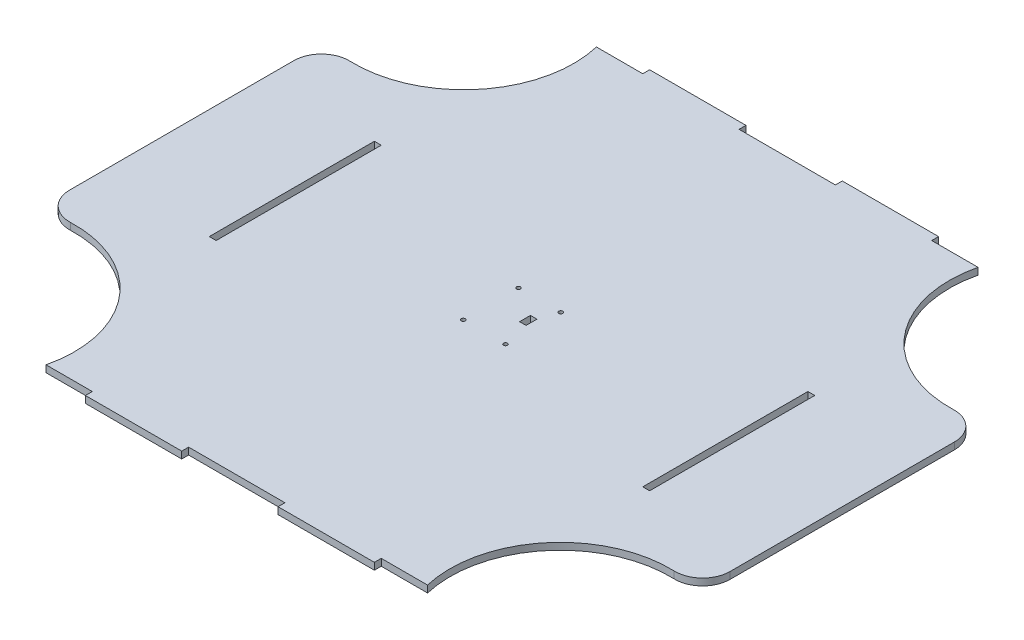
from build123d import *

# Parameters (mm, degrees)
BOSS_EXTRUDE1_DEPTH = 6.35
SKETCH4_W           = 88.9
SKETCH4_H           = 6.35
CUT_EXTRUDE2_DEPTH  = 401.905830589
FILLET2_R           = 25.4
SKETCH6_W           = 6.35
SKETCH6_H           = 152.4
CUT_EXTRUDE3_DEPTH  = 401.905830589
SKETCH7_W           = 6
SKETCH7_H           = 10
SKETCH7_R           = 1.8
CUT_EXTRUDE4_DEPTH  = 401.905830589


with BuildPart() as part:
    # Sketch1 → Boss-Extrude1 (new body)
    with BuildSketch(Plane(origin=(0, 0, 0), x_dir=(1, 0, 0), z_dir=(0, 1, 0))):
        with BuildLine():
            ThreePointArc((-304.8, -133.35), (-203.058992682, -158.608992682), (-177.8, -260.35))
            Line((-177.8, -260.35), (177.8, -260.35))
            ThreePointArc((177.8, -260.35), (203.058992682, -158.608992682), (304.8, -133.35))
            Line((304.8, -133.35), (304.8, 133.35))
            ThreePointArc((304.8, 133.35), (203.058992682, 158.608992682), (177.8, 260.35))
            Line((177.8, 260.35), (-177.8, 260.35))
            ThreePointArc((-177.8, 260.35), (-203.058992682, 158.608992682), (-304.8, 133.35))
            Line((-304.8, 133.35), (-304.8, -133.35))
        make_face()
    extrude(amount=BOSS_EXTRUDE1_DEPTH)

    # Sketch4 → Cut-Extrude2 (cut, through all)
    with BuildSketch(Plane(origin=(0, 6.35, 0), x_dir=(1, 0, 0), z_dir=(0, 1, 0))):
        with Locations((-177.8, 257.175)):
            Rectangle(SKETCH4_W, SKETCH4_H)
        with Locations((0, 257.175)):
            Rectangle(SKETCH4_W, SKETCH4_H)
        with Locations((177.8, 257.175)):
            Rectangle(SKETCH4_W, SKETCH4_H)
    cut_extrude2 = extrude(amount=-CUT_EXTRUDE2_DEPTH, mode=Mode.SUBTRACT)

    # Mirror2: Cut-Extrude2 across plane
    add(cut_extrude2.mirror(Plane.XY), mode=Mode.SUBTRACT)

    # Fillet2
    fillet2_edges = [part.edges().sort_by_distance(p)[0] for p in [
        (-304.8, 3.175, 133.35),
        (-304.8, 3.175, -133.35),
        (304.8, 3.175, -133.35),
        (304.8, 3.175, 133.35),
    ]]
    fillet(fillet2_edges, radius=FILLET2_R)

    # Sketch6 → Cut-Extrude3 (cut, through all)
    with BuildSketch(Plane(origin=(0, 6.35, 0), x_dir=(1, 0, 0), z_dir=(0, 1, 0))):
        with Locations((-200.025, 0)):
            Rectangle(SKETCH6_W, SKETCH6_H)
        with Locations((200.025, 0)):
            Rectangle(SKETCH6_W, SKETCH6_H)
    extrude(amount=-CUT_EXTRUDE3_DEPTH, mode=Mode.SUBTRACT)

    # Sketch7 → Cut-Extrude4 (cut, through all)
    with BuildSketch(Plane(origin=(0, 6.35, 0), x_dir=(1, 0, 0), z_dir=(0, 1, 0))):
        with Locations((11, 4)):
            Rectangle(SKETCH7_W, SKETCH7_H)
        with Locations(Location((-19.5, 25.5, 0), (0, 0, 270))):
            Circle(SKETCH7_R)
        with Locations(Location((-19.5, -25.5, 0), (0, 0, 90))):
            Circle(SKETCH7_R)
        with Locations(Location((19.5, -25.5, 0), (0, 0, 270))):
            Circle(SKETCH7_R)
        with Locations(Location((19.5, 25.5, 0), (0, 0, 90))):
            Circle(SKETCH7_R)
    extrude(amount=-CUT_EXTRUDE4_DEPTH, mode=Mode.SUBTRACT)


solid = part.part
